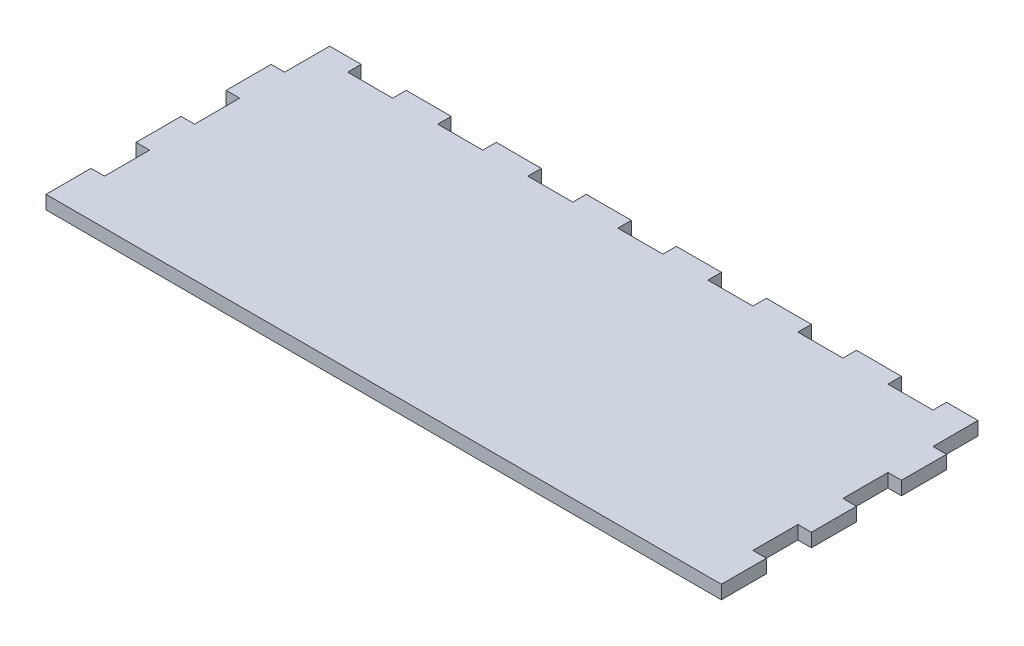
from build123d import *

# Parameters (mm, degrees)
SKETCH1_W               = 150
SKETCH1_H               = 60
BOSS_EXTRUDE1_DEPTH     = 3
SKETCH2_W               = 3
SKETCH2_H               = 10
CUT_EXTRUDE1_DEPTH      = 81.833161512
LPATTERN1_COUNT         = 3
LPATTERN1_PITCH         = 20
MIRROR1_COPY_1_SKETCH_W = 3
MIRROR1_COPY_1_SKETCH_H = 10
MIRROR1_COPY_1_DEPTH    = 81.833161512
MIRROR1_COPY_2_SKETCH_W = 3
MIRROR1_COPY_2_SKETCH_H = 10
MIRROR1_COPY_2_DEPTH    = 81.833161512
SKETCH3_W               = 10
SKETCH3_H               = 3
CUT_EXTRUDE2_DEPTH      = 81.833161512
LPATTERN2_COUNT         = 7
LPATTERN2_PITCH         = 20


with BuildPart() as part:
    # Sketch1 → Boss-Extrude1 (new body)
    with BuildSketch(Plane(origin=(0, 0, 0), x_dir=(1, 0, 0), z_dir=(0, 1, 0))):
        Rectangle(SKETCH1_W, SKETCH1_H)
    extrude(amount=BOSS_EXTRUDE1_DEPTH)

    # Sketch2 → Cut-Extrude1 (cut, through all)
    with BuildSketch(Plane(origin=(0, 3, 0), x_dir=(1, 0, 0), z_dir=(0, 1, 0))):
        with Locations((73.5, -15)):
            Rectangle(SKETCH2_W, SKETCH2_H)
    cut_extrude1 = extrude(amount=-CUT_EXTRUDE1_DEPTH, mode=Mode.SUBTRACT)

    # LPattern1: Cut-Extrude1 ×3
    with Locations(*[(0, 0, -i * LPATTERN1_PITCH) for i in range(1, LPATTERN1_COUNT)]):
        add(cut_extrude1, mode=Mode.SUBTRACT)

    # Mirror1: Cut-Extrude1 across plane
    add(cut_extrude1.mirror(Plane(origin=(0, 0, 0), x_dir=(0, 0, 1), z_dir=(1, 0, 0))), mode=Mode.SUBTRACT)

    # Mirror1 copy 1 sketch → Mirror1 copy 1 (cut, through all)
    with BuildSketch(Plane(origin=(0, 3, -20), x_dir=(-1, 0, 0), z_dir=(0, 1, 0))):
        with Locations((73.5, 15)):
            Rectangle(MIRROR1_COPY_1_SKETCH_W, MIRROR1_COPY_1_SKETCH_H)
    extrude(amount=-MIRROR1_COPY_1_DEPTH, mode=Mode.SUBTRACT)

    # Mirror1 copy 2 sketch → Mirror1 copy 2 (cut, through all)
    with BuildSketch(Plane(origin=(0, 3, -40), x_dir=(-1, 0, 0), z_dir=(0, 1, 0))):
        with Locations((73.5, 15)):
            Rectangle(MIRROR1_COPY_2_SKETCH_W, MIRROR1_COPY_2_SKETCH_H)
    extrude(amount=-MIRROR1_COPY_2_DEPTH, mode=Mode.SUBTRACT)

    # Sketch3 → Cut-Extrude2 (cut, through all)
    with BuildSketch(Plane(origin=(0, 3, 0), x_dir=(1, 0, 0), z_dir=(0, 1, 0))):
        with Locations((-60, 28.5)):
            Rectangle(SKETCH3_W, SKETCH3_H)
    cut_extrude2 = extrude(amount=-CUT_EXTRUDE2_DEPTH, mode=Mode.SUBTRACT)

    # LPattern2: Cut-Extrude2 ×7
    with Locations(*[(i * LPATTERN2_PITCH, 0, 0) for i in range(1, LPATTERN2_COUNT)]):
        add(cut_extrude2, mode=Mode.SUBTRACT)


solid = part.part
